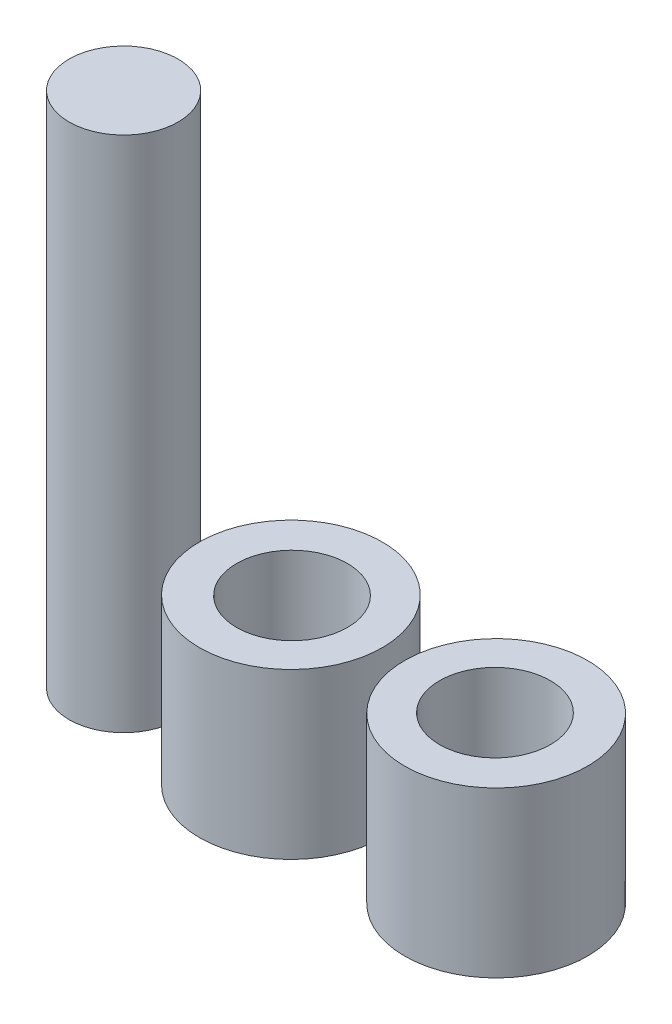
from build123d import *

# Parameters (mm, degrees)
SKETCH1_R           = 1.475
BOSS_EXTRUDE1_DEPTH = 14
SKETCH2_R           = 2.475
BOSS_EXTRUDE2_DEPTH = 4.45
SKETCH3_R           = 1.5
CUT_EXTRUDE1_DEPTH  = 13.096093236


with BuildPart() as part:
    # Sketch1 → Boss-Extrude1 (new body)
    with BuildSketch(Plane(origin=(0, 0, 0), x_dir=(1, 0, 0), z_dir=(0, 1, 0))):
        with Locations(Location((0, 0, 0), (0, 0, 270))):
            Circle(SKETCH1_R)
    extrude(amount=BOSS_EXTRUDE1_DEPTH)


with BuildPart() as body_2:
    # Sketch2 → Boss-Extrude2 (new body)
    with BuildSketch(Plane(origin=(0, 0, 0), x_dir=(1, 0, 0), z_dir=(0, 1, 0))):
        with Locations(Location((4.524096126, 0, 0), (0, 0, 270))):
            Circle(SKETCH2_R)
    extrude(amount=BOSS_EXTRUDE2_DEPTH)

    # Sketch3 → Cut-Extrude1 (cut, through all)
    with BuildSketch(Plane(origin=(0, 4.45, 0), x_dir=(1, 0, 0), z_dir=(0, 1, 0))):
        with Locations(Location((4.555318966, 0, 0), (0, 0, 270))):
            Circle(SKETCH3_R)
    extrude(amount=-CUT_EXTRUDE1_DEPTH, mode=Mode.SUBTRACT)


with BuildPart() as body_3:
    # Mirror23: mirrored copy
    add(body_2.part.mirror(Plane(origin=(7.3, 0, 0), x_dir=(0, 0, 1), z_dir=(1, 0, 0))))


solid = Compound([part.part, body_2.part, body_3.part])
